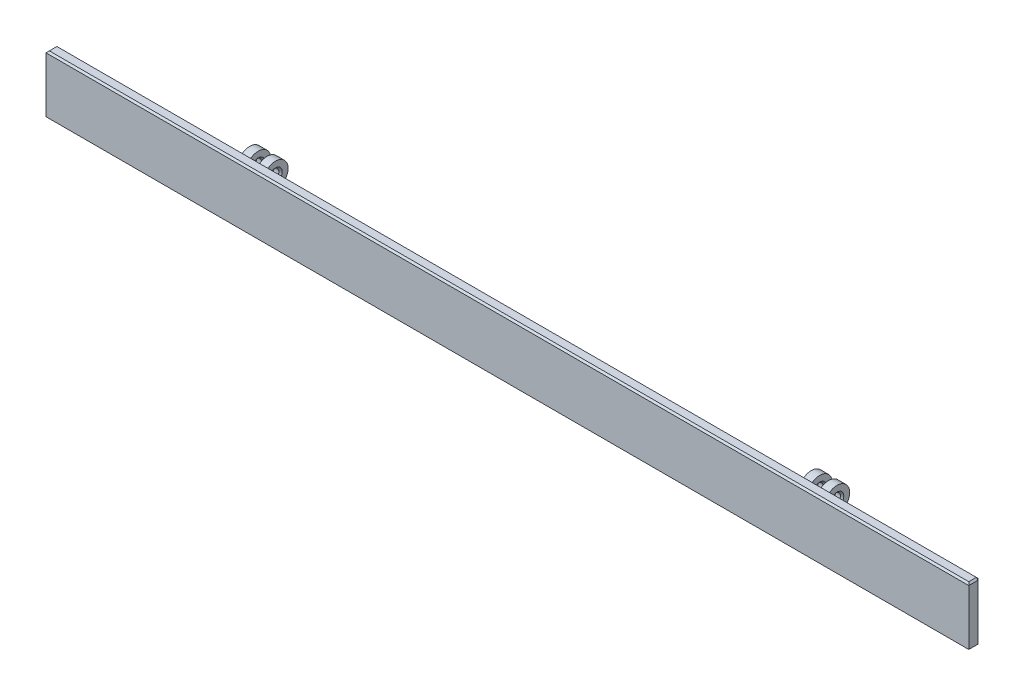
from build123d import *

# Parameters (mm, degrees)
SKETCH_1_W               = 6.5
SKETCH_1_H               = 35
EXTRUDE_1_DEPTH          = 550
SKETCH_3_R               = 3
EXTRUDE_2_DEPTH          = 5
MIRROR_2_COPY_1_SKETCH_R = 3
MIRROR_2_COPY_1_DEPTH    = 5
CHAMFER_1_SIZE           = 1
CHAMFER_2_SIZE           = 1


with BuildPart() as part:
    # 草图1 → 凸台-拉伸1 (new body)
    with BuildSketch(Plane(origin=(0, 0, 0), x_dir=(0, 0, -1), z_dir=(1, 0, 0))):
        with Locations((3.25, -17.5)):
            Rectangle(SKETCH_1_W, SKETCH_1_H)
    extrude(amount=EXTRUDE_1_DEPTH)

    # 草图3 → 凸台-拉伸2 (add)
    with BuildSketch(Plane(origin=(450, 0, 0), x_dir=(0, 0, -1), z_dir=(1, 0, 0))):
        with BuildLine():
            Line((6.5, -21.25), (6.5, -13.75))
            Line((6.5, -13.75), (15.004809472, -13.75))
            ThreePointArc((15.004809472, -13.75), (29, -17.5), (15.004809472, -21.25))
            Line((15.004809472, -21.25), (6.5, -21.25))
        make_face()
        with Locations((21.5, -17.5)):
            Circle(SKETCH_3_R, mode=Mode.SUBTRACT)
    extrude_2 = extrude(amount=-EXTRUDE_2_DEPTH)

    # 镜向1: 凸台-拉伸2 across plane
    add(extrude_2.mirror(Plane.ZY.offset(-442.35)))

    # 镜向2: 凸台-拉伸2 across plane
    add(extrude_2.mirror(Plane(origin=(275, 0, 0), x_dir=(0, 0, 1), z_dir=(1, 0, 0))))

    # 镜向2 copy 1 sketch → 镜向2 copy 1 (add)
    with BuildSketch(Plane(origin=(115.3, 0, 0), x_dir=(0, 0, -1), z_dir=(1, 0, 0))):
        with BuildLine():
            Line((6.5, -21.25), (6.5, -13.75))
            Line((6.5, -13.75), (15.004809472, -13.75))
            ThreePointArc((15.004809472, -13.75), (29, -17.5), (15.004809472, -21.25))
            Line((15.004809472, -21.25), (6.5, -21.25))
        make_face()
        with Locations((21.5, -17.5)):
            Circle(MIRROR_2_COPY_1_SKETCH_R, mode=Mode.SUBTRACT)
    extrude(amount=-MIRROR_2_COPY_1_DEPTH)

    # 倒角1
    chamfer_1_edges = [part.edges().sort_by_distance(p)[0] for p in [
        (550, -17.5, -6.5),
        (550, 0, -3.25),
        (445, -17.5, -6.5),
        (447.5, -21.25, -6.5),
        (447.5, -13.75, -6.5),
        (445, -17.5, -18.5),
        (450, -17.5, -6.5),
        (450, -17.5, -18.5),
        (439.7, -17.5, -6.5),
        (434.7, -17.5, -18.5),
        (434.7, -17.5, -6.5),
        (437.2, -13.75, -6.5),
        (437.2, -21.25, -6.5),
        (439.7, -17.5, -18.5),
        (105, -17.5, -6.5),
        (100, -17.5, -6.5),
        (0, 0, -3.25),
        (102.5, -13.75, -6.5),
        (102.5, -21.25, -6.5),
        (0, -17.5, -6.5),
        (0, -35, -3.25),
        (110.3, -17.5, -6.5),
        (112.8, -21.25, -6.5),
        (112.8, -13.75, -6.5),
        (115.3, -17.5, -6.5),
        (275, 0, 0),
        (275, 0, -6.5),
        (275, -35, -6.5),
        (275, -35, 0),
        (550, -35, -3.25),
    ]]
    chamfer(chamfer_1_edges, length=CHAMFER_1_SIZE)

    # 倒角2
    chamfer_2_edges = [part.edges().sort_by_distance(p)[0] for p in [
        (100, -17.5, -18.5),
        (105, -17.5, -18.5),
        (110.3, -17.5, -18.5),
        (115.3, -17.5, -18.5),
    ]]
    chamfer(chamfer_2_edges, length=CHAMFER_2_SIZE)


solid = part.part
